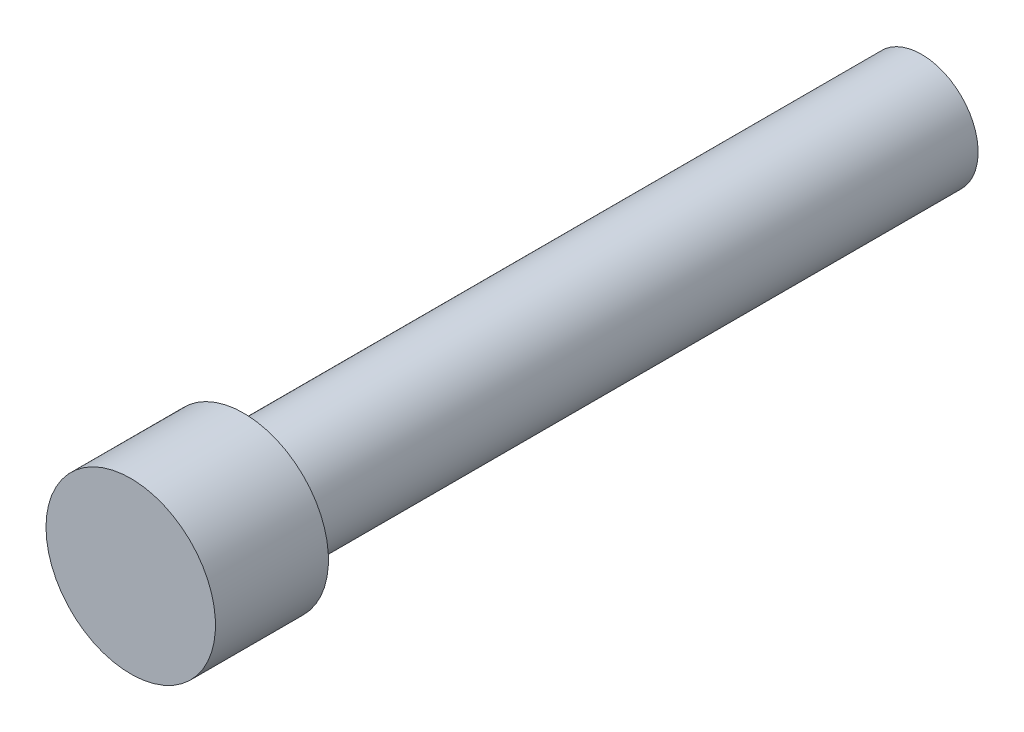
from build123d import *


with BuildPart() as part:
    # Sketch2 → Revolve1 (revolve)
    with BuildSketch(Plane(origin=(0, 0, 0), x_dir=(0, 0, -1), z_dir=(1, 0, 0)), mode=Mode.PRIVATE) as revolve1_sk:
        Polygon((-22.225, 2.38125), (-22.225, 0), (-17.675184671, 0), (-19.05, 2.38125), align=None)
        with BuildLine():
            ThreePointArc((-21.9075, 4.7625), (-22.132006403, 4.669506403), (-22.225, 4.445))
            Line((-22.225, 4.445), (-22.225, 4.7625))
            Line((-22.225, 4.7625), (-21.9075, 4.7625))
        make_face()
        with BuildLine():
            Line((-22.225, 2.38125), (-19.05, 2.38125))
            Line((-19.05, 2.38125), (-19.05, 4.7625))
            Line((-19.05, 4.7625), (-21.9075, 4.7625))
            ThreePointArc((-21.9075, 4.7625), (-22.132006403, 4.669506403), (-22.225, 4.445))
            Line((-22.225, 4.445), (-22.225, 2.38125))
        make_face()
        with BuildLine():
            Line((-17.675184671, 0), (22.225, 0))
            Line((22.225, 0), (22.225, 2.2225))
            Line((22.225, 2.2225), (21.2725, 3.175))
            Line((21.2725, 3.175), (-15.875, 3.175))
            Line((-15.875, 3.175), (-15.875, 4.445))
            ThreePointArc((-15.875, 4.445), (-15.967993597, 4.669506403), (-16.1925, 4.7625))
            Line((-16.1925, 4.7625), (-19.05, 4.7625))
            Line((-19.05, 4.7625), (-19.05, 2.38125))
            Line((-19.05, 2.38125), (-17.675184671, 0))
        make_face()
        with BuildLine():
            ThreePointArc((-15.875, 4.445), (-15.967993597, 4.669506403), (-16.1925, 4.7625))
            Line((-16.1925, 4.7625), (-15.875, 4.7625))
            Line((-15.875, 4.7625), (-15.875, 4.445))
        make_face()
        Polygon((22.225, 3.175), (22.225, 2.2225), (21.2725, 3.175), align=None)
    revolve(revolve1_sk.sketch.rotate(Axis((0, 0, -22.225), (0, 0, 1)), 90), axis=Axis((0, 0, -22.225), (0, 0, 1)))


solid = part.part
